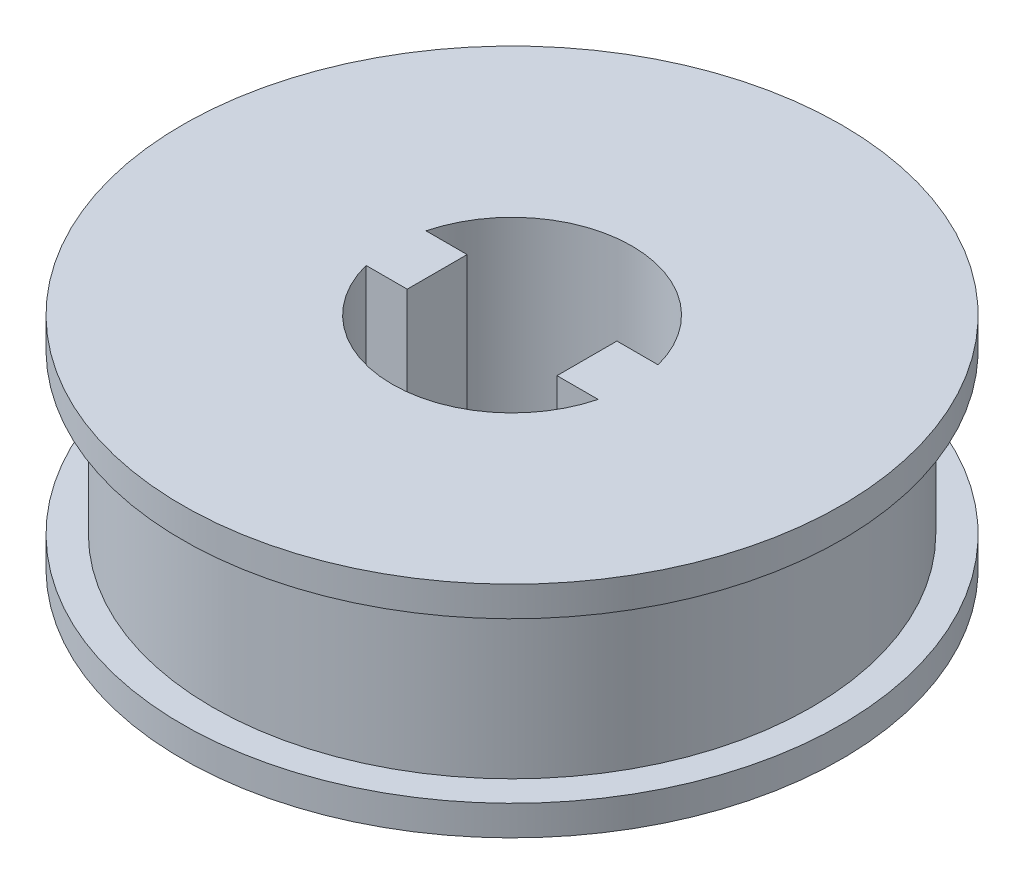
from build123d import *

# Parameters (mm, degrees)
ESQUISSE6_W        = 4.5
ESQUISSE6_H        = 3
BOSS_EXTRU_1_DEPTH = 11


with BuildPart() as part:
    # Esquisse2 → Révolution1 (revolve)
    with BuildSketch(Plane.XY, mode=Mode.PRIVATE) as r_volution1_sk:
        Polygon((6, 5.365286165), (6, -5.634713835), (16.5, -5.634713835), (16.5, -4.134713835), (15, -4.134713835), (15, 3.865286165), (16.5, 3.865286165), (16.5, 5.365286165), align=None)
    revolve(r_volution1_sk.sketch.rotate(Axis((0, 0, 0), (0, 1, 0)), 90), axis=Axis((0, 0, 0), (0, 1, 0)))

    # Esquisse6 → Boss.-Extru.1 (add)
    with BuildSketch(Plane(origin=(0, 5.365286165, 0), x_dir=(1, 0, 0), z_dir=(0, 1, 0))):
        with Locations((-6, 0)):
            Rectangle(ESQUISSE6_W, ESQUISSE6_H)
        with Locations((6, 0)):
            Rectangle(ESQUISSE6_W, ESQUISSE6_H)
    extrude(amount=-BOSS_EXTRU_1_DEPTH)


solid = part.part
